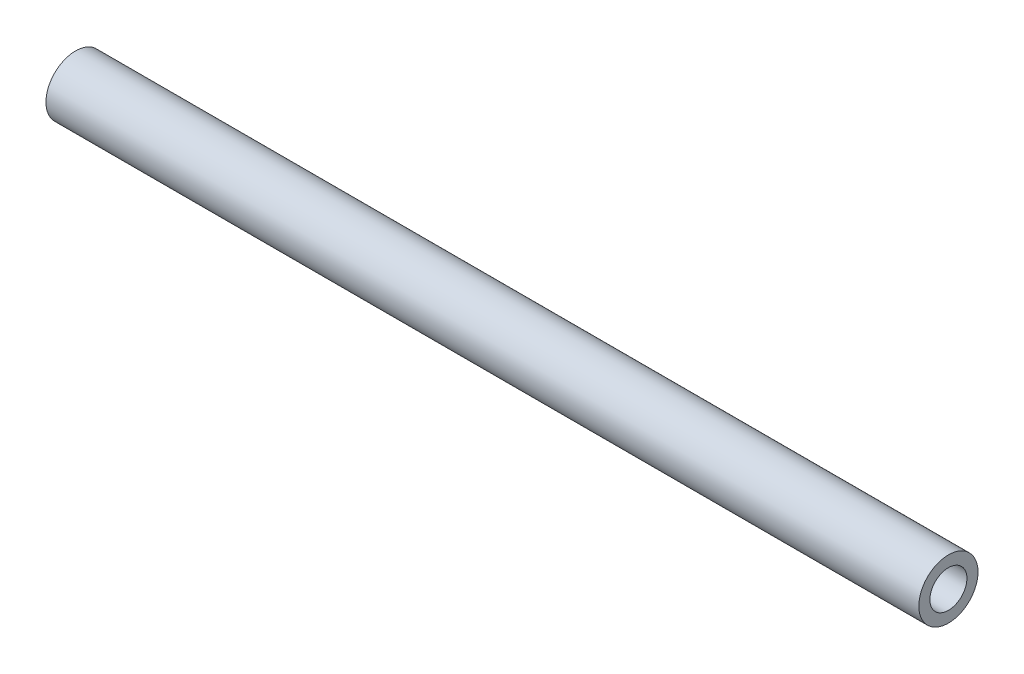
from build123d import *

# Parameters (mm, degrees)
SKETCH2_R           = 4
SKETCH2_R_2         = 2.5
BOSS_EXTRUDE1_DEPTH = 118


with BuildPart() as part:
    # Sketch2 → Boss-Extrude1 (new body)
    with BuildSketch(Plane.YZ):
        with Locations(Location((0, 0, 0), (0, 0, 270))):
            Circle(SKETCH2_R)
        with Locations(Location((0, 0, 0), (0, 0, 270))):
            Circle(SKETCH2_R_2, mode=Mode.SUBTRACT)
    extrude(amount=BOSS_EXTRUDE1_DEPTH)


solid = part.part
